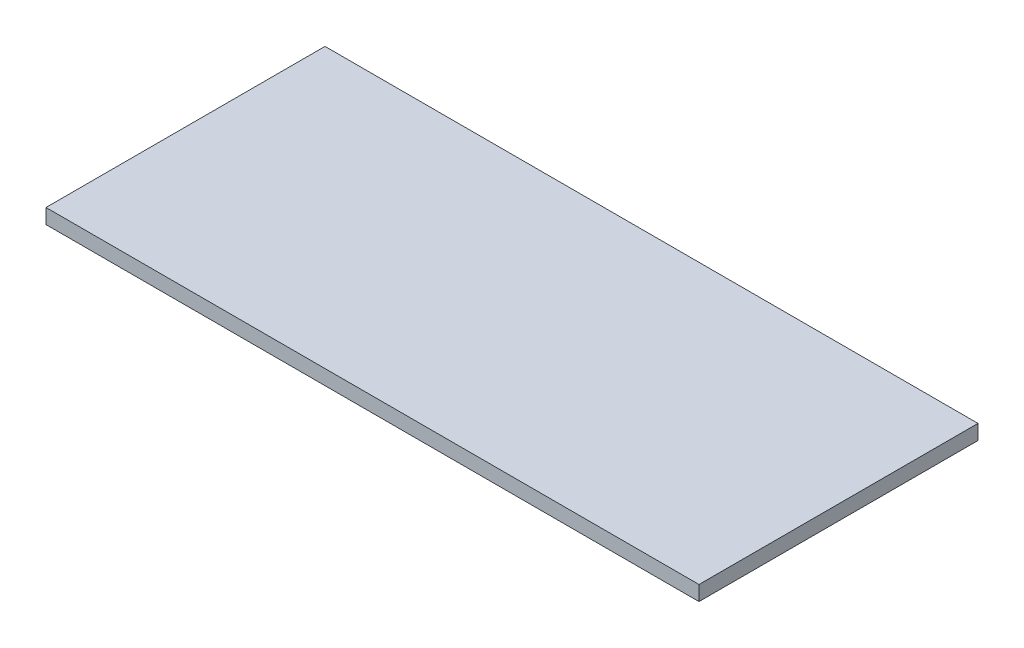
from build123d import *

# Parameters (mm, degrees)
SKETCH1_W           = 279.4
SKETCH1_H           = 119.38
BOSS_EXTRUDE1_DEPTH = 6.35


with BuildPart() as part:
    # Sketch1 → Boss-Extrude1 (new body)
    with BuildSketch(Plane(origin=(0, 0, 0), x_dir=(1, 0, 0), z_dir=(0, 1, 0))):
        with Locations((139.7, 59.69)):
            Rectangle(SKETCH1_W, SKETCH1_H)
    extrude(amount=BOSS_EXTRUDE1_DEPTH)


solid = part.part
